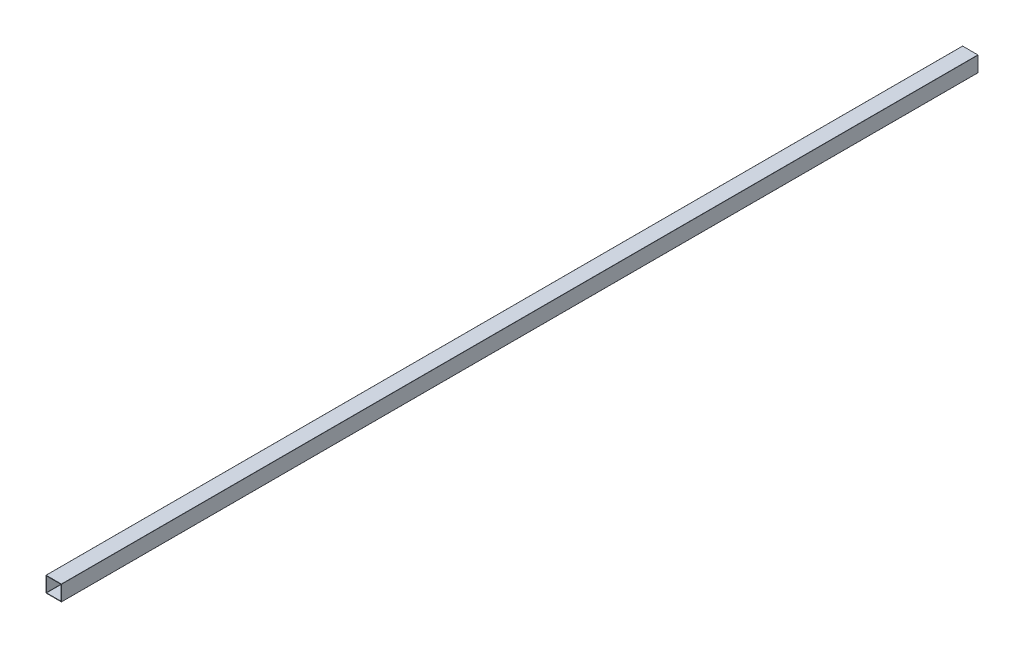
from build123d import *

# Parameters (mm, degrees)
CROQUIS1_W              = 101.6
CROQUIS1_H              = 101.6
CROQUIS1_W_2            = 95.52
CROQUIS1_H_2            = 95.52
SALIENTE_EXTRUIR1_DEPTH = 6000
REDONDEO1_R             = 1


with BuildPart() as part:
    # Croquis1 → Saliente-Extruir1 (new body)
    with BuildSketch(Plane.XY):
        Rectangle(CROQUIS1_W, CROQUIS1_H)
        Rectangle(CROQUIS1_W_2, CROQUIS1_H_2, mode=Mode.SUBTRACT)
    extrude(amount=-SALIENTE_EXTRUIR1_DEPTH)

    # Redondeo1
    redondeo1_edges = [part.edges().sort_by_distance(p)[0] for p in [
        (47.76, -47.76, -3000),
        (-47.76, -47.76, -3000),
        (-47.76, 47.76, -3000),
        (47.76, 47.76, -3000),
        (50.8, -50.8, -3000),
        (-50.8, -50.8, -3000),
        (-50.8, 50.8, -3000),
        (50.8, 50.8, -3000),
    ]]
    fillet(redondeo1_edges, radius=REDONDEO1_R)


solid = part.part
